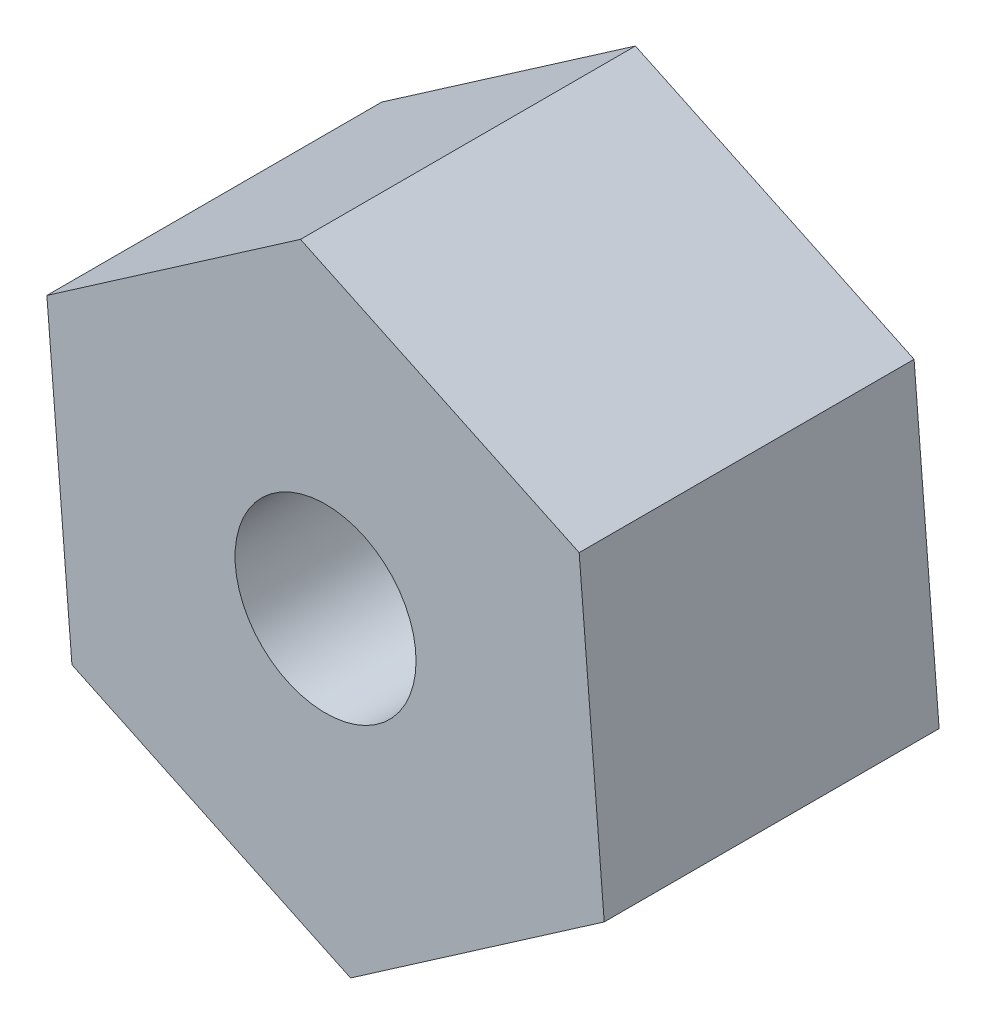
from build123d import *

# Parameters (mm, degrees)
ESQUISSE1_R        = 1
BOSS_EXTRU_1_DEPTH = 3.7


with BuildPart() as part:
    # Esquisse1 → Boss.-Extru.1 (new body)
    with BuildSketch(Plane.XY):
        Polygon((-0.276697102, 3.39511002), (-3.078600077, 1.45792829), (-2.801902975, -1.937181729), (0.276697102, -3.39511002), (3.078600077, -1.45792829), (2.801902975, 1.937181729), align=None)
        Circle(ESQUISSE1_R, mode=Mode.SUBTRACT)
    extrude(amount=BOSS_EXTRU_1_DEPTH)


solid = part.part
